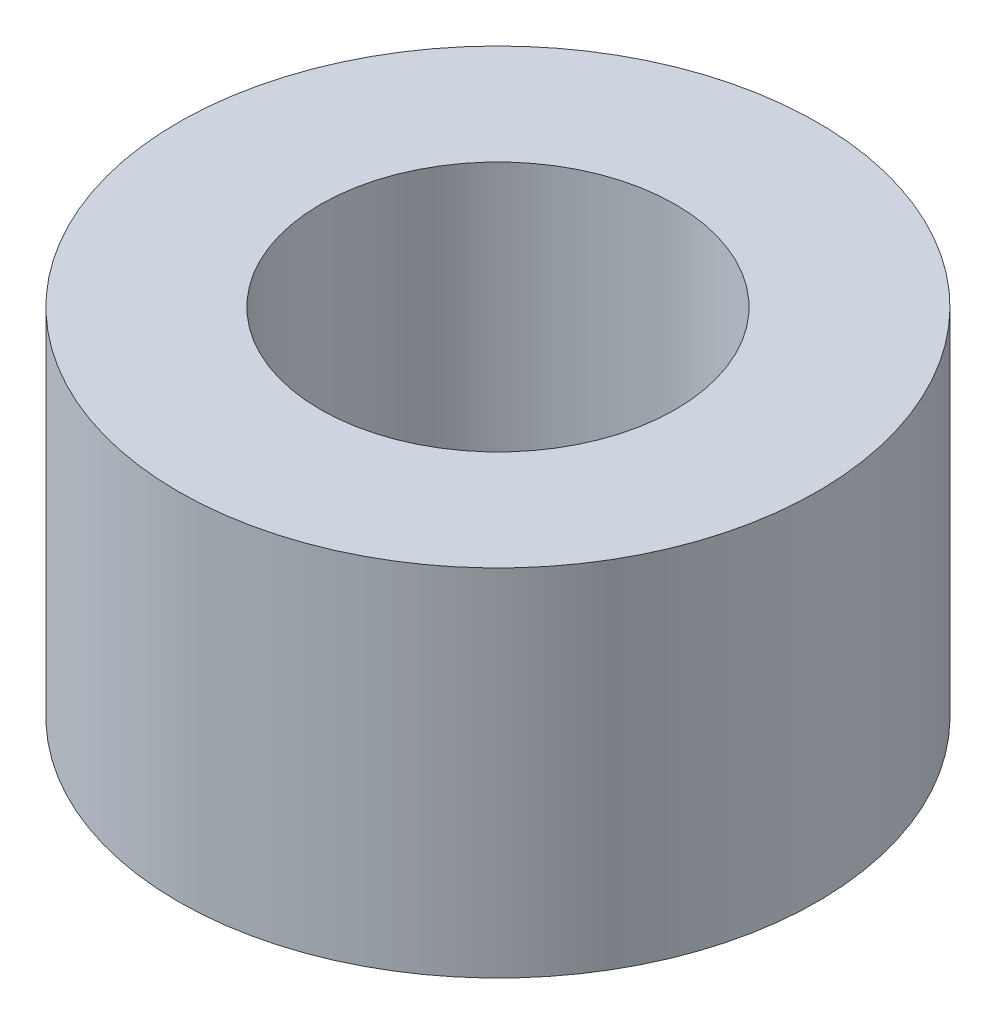
from build123d import *

# Parameters (mm, degrees)
SKETCH1_R           = 4.5
SKETCH1_R_2         = 2.5
BOSS_EXTRUDE1_DEPTH = 5


with BuildPart() as part:
    # Sketch1 → Boss-Extrude1 (new body)
    with BuildSketch(Plane(origin=(0, 0, 0), x_dir=(1, 0, 0), z_dir=(0, 1, 0))):
        with Locations(Location((0, 0, 0), (0, 0, 270))):
            Circle(SKETCH1_R)
        with Locations(Location((0, 0, 0), (0, 0, 270))):
            Circle(SKETCH1_R_2, mode=Mode.SUBTRACT)
    extrude(amount=BOSS_EXTRUDE1_DEPTH)


solid = part.part
